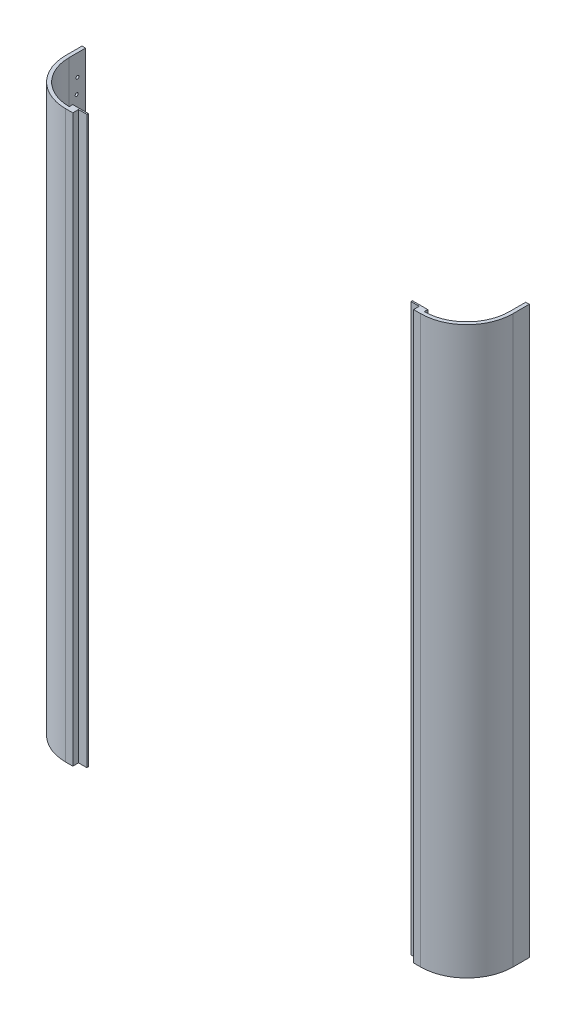
from build123d import *

# Parameters (mm, degrees)
EXTRUDE_1_DEPTH          = 797
EXTRUDE_1_2_DEPTH        = 797
CUT_EXTRUDE_1_DEPTH      = 20
CUT_EXTRUDE_1_DEPTH_BACK = 1061.29395051
SKETCH_3_R               = 2.15


with BuildPart() as part:
    # 草图2 → 凸台-拉伸1 (new body)
    with BuildSketch(Plane(origin=(0, 0, 0), x_dir=(1, 0, 0), z_dir=(0, 1, 0))):
        with BuildLine():
            Line((-278.622282089, -303.670625798), (-278.622282089, -308.670625798))
            ThreePointArc((-278.622282089, -308.670625798), (-321.04868896, -291.097032669), (-338.622282089, -248.670625798))
            Line((-338.622282089, -248.670625798), (-338.622282089, -225.670625798))
            Line((-338.622282089, -225.670625798), (-343.622282089, -225.670625798))
            Line((-343.622282089, -225.670625798), (-343.622282089, -248.670625798))
            ThreePointArc((-343.622282089, -248.670625798), (-324.584222866, -294.632566575), (-278.622282089, -313.670625798))
            Line((-278.622282089, -313.670625798), (-268.622282089, -313.670625798))
            Line((-268.622282089, -313.670625798), (-268.622282089, -308.670625798))
            Line((-268.622282089, -308.670625798), (-268.622282089, -305.670625798))
            Line((-268.622282089, -305.670625798), (-256.854692605, -305.670625798))
            Line((-256.854692605, -305.670625798), (-256.854692605, -303.670625798))
            Line((-256.854692605, -303.670625798), (-278.622282089, -303.670625798))
        make_face()
    extrude(amount=EXTRUDE_1_DEPTH)

    # 草图3 → 切除-拉伸1 (cut, two sides: drawn at the far end of the back side and taken through both)
    with BuildSketch(Plane(origin=(-338.622282089, 0, 0), x_dir=(0, 0, -1), z_dir=(1, 0, 0)).offset(-CUT_EXTRUDE_1_DEPTH_BACK)):
        with Locations((-237.170625798, 767)):
            Circle(SKETCH_3_R)
        with Locations((-238.170625798, 746.5)):
            Circle(SKETCH_3_R)
        with Locations((-237.170625798, 726)):
            Circle(SKETCH_3_R)
        with Locations(Location((-237.170625798, 85, 0), (0, 0, 180))):
            Circle(SKETCH_3_R)
        with Locations(Location((-238.170625798, 64.5, 0), (0, 0, 180))):
            Circle(SKETCH_3_R)
        with Locations(Location((-237.170625798, 44, 0), (0, 0, 180))):
            Circle(SKETCH_3_R)
        with Locations((-237.170625798, 426)):
            Circle(SKETCH_3_R)
        with Locations((-238.170625798, 405.5)):
            Circle(SKETCH_3_R)
        with Locations((-237.170625798, 385)):
            Circle(SKETCH_3_R)
    extrude(amount=CUT_EXTRUDE_1_DEPTH + CUT_EXTRUDE_1_DEPTH_BACK, mode=Mode.SUBTRACT)


with BuildPart() as body_2:
    # 草图2 → Extrude 1 2 (new body)
    with BuildSketch(Plane(origin=(0, 0, 0), x_dir=(1, 0, 0), z_dir=(0, 1, 0))):
        with BuildLine():
            Line((281.377717911, -248.670625798), (281.377717911, -225.670625798))
            Line((281.377717911, -225.670625798), (286.377717911, -225.670625798))
            Line((286.377717911, -225.670625798), (286.377717911, -248.670625798))
            ThreePointArc((286.377717911, -248.670625798), (267.339658688, -294.632566575), (221.377717911, -313.670625798))
            Line((221.377717911, -313.670625798), (211.377717911, -313.670625798))
            Line((211.377717911, -313.670625798), (211.377717911, -308.670625798))
            Line((211.377717911, -308.670625798), (211.377717911, -305.670625798))
            Line((211.377717911, -305.670625798), (199.610128426, -305.670625798))
            Line((199.610128426, -305.670625798), (199.610128426, -303.670625798))
            Line((199.610128426, -303.670625798), (221.377717911, -303.670625798))
            Line((221.377717911, -303.670625798), (221.377717911, -308.670625798))
            ThreePointArc((221.377717911, -308.670625798), (263.804124782, -291.097032669), (281.377717911, -248.670625798))
        make_face()
    extrude(amount=EXTRUDE_1_2_DEPTH)


solid = Compound([part.part, body_2.part])
